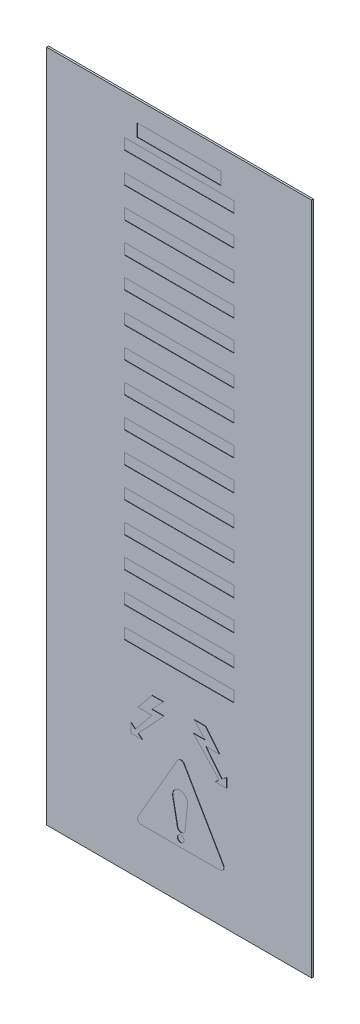
from build123d import *

# Parameters (mm, degrees)
CROQUIS2_W              = 70
CROQUIS2_H              = 178
SALIENTE_EXTRUIR1_DEPTH = 0.5
SALIENTE_EXTRUIR3_DEPTH = 0.1
CROQUIS7_W              = 22.17688196
CROQUIS7_H              = 3.307809841
CORTAR_EXTRUIR1_DEPTH   = 0.1
CROQUIS12_R             = 0.884703758
CORTAR_EXTRUIR6_DEPTH   = 0.1
SALIENTE_EXTRUIR7_DEPTH = 0.1
CROQUIS14_W             = 28.951405582
CROQUIS14_H             = 2.886934834
CORTAR_EXTRUIR9_DEPTH   = 0.1


with BuildPart() as part:
    # Croquis2 → Saliente-Extruir1 (new body)
    with BuildSketch(Plane.XY):
        Rectangle(CROQUIS2_W, CROQUIS2_H)
    extrude(amount=SALIENTE_EXTRUIR1_DEPTH)

    # Croquis3 → Saliente-Extruir3 (add)
    with BuildSketch(Plane.XY.offset(0.5)):
        with BuildLine():
            Line((-9.855540385, -76.309745211), (10.927527897, -76.309745211))
            ThreePointArc((10.927527897, -76.309745211), (11.793597531, -75.809668594), (11.79346482, -74.809591989))
            Line((11.79346482, -74.809591989), (1.401930679, -56.818279148))
            ThreePointArc((1.401930679, -56.818279148), (0.535993756, -56.31843237), (-0.329943167, -56.818279148))
            Line((-0.329943167, -56.818279148), (-10.721477308, -74.809591989))
            ThreePointArc((-10.721477308, -74.809591989), (-10.721610019, -75.809668594), (-9.855540385, -76.309745211))
        make_face()
    extrude(amount=SALIENTE_EXTRUIR3_DEPTH)

    # Croquis7 → Cortar-Extruir1 (cut)
    with BuildSketch(Plane.XY.offset(0.5)):
        with Locations((0, 81.996928937)):
            Rectangle(CROQUIS7_W, CROQUIS7_H)
    extrude(amount=-CORTAR_EXTRUIR1_DEPTH, mode=Mode.SUBTRACT)

    # Croquis12 → Cortar-Extruir6 (cut)
    with BuildSketch(Plane.XY.offset(0.6)):
        with Locations((0.537972258, -74.332087137)):
            Circle(CROQUIS12_R)
        with BuildLine():
            Line((-0.348710002, -71.972665126), (-1.628640607, -65.425857317))
            ThreePointArc((-1.628640607, -65.425857317), (0.302962598, -63.346803486), (2.382016429, -65.278406691))
            Line((2.382016429, -65.278406691), (1.678502804, -71.951849763))
            ThreePointArc((1.678502804, -71.951849763), (0.674168301, -72.865249783), (-0.348710002, -71.972665126))
        make_face()
    extrude(amount=-CORTAR_EXTRUIR6_DEPTH, mode=Mode.SUBTRACT)

    # Croquis4 → Saliente-Extruir7 (add)
    with BuildSketch(Plane.XY.offset(0.5)):
        Polygon((-4.107800338, -45.327798296), (-7.077418664, -45.327798296), (-10.721484373, -49.854681807), (-7.077418664, -49.854681807), (-11.437215381, -55.270690584), (-12.621463736, -54.317390413), (-12.621463736, -56.74183704), (-9.609666384, -56.74183704), (-10.721484373, -55.846842105), (-3.908016847, -48.520813848), (-7.077418664, -48.520813848), align=None)
        Polygon((9.609666384, -56.74183704), (10.721484373, -55.846842105), (3.908016847, -48.520813848), (7.077418664, -48.520813848), (4.107800338, -45.327798296), (7.077418664, -45.327798296), (10.721484373, -49.854681807), (7.077418664, -49.854681807), (11.437215381, -55.270690584), (12.621463736, -54.317390413), (12.621463736, -56.74183704), align=None)
    extrude(amount=SALIENTE_EXTRUIR7_DEPTH)

    # Croquis14 → Cortar-Extruir9 (cut)
    with BuildSketch(Plane.XY.offset(0.5)):
        with Locations((0, 77.150486091)):
            Rectangle(CROQUIS14_W, CROQUIS14_H)
        with Locations((0, 69.150486091)):
            Rectangle(CROQUIS14_W, CROQUIS14_H)
        with Locations((0, 61.150486091)):
            Rectangle(CROQUIS14_W, CROQUIS14_H)
        with Locations((0, 53.150486091)):
            Rectangle(CROQUIS14_W, CROQUIS14_H)
        with Locations((0, 45.150486091)):
            Rectangle(CROQUIS14_W, CROQUIS14_H)
        with Locations((0, 37.150486091)):
            Rectangle(CROQUIS14_W, CROQUIS14_H)
        with Locations((0, 29.150486091)):
            Rectangle(CROQUIS14_W, CROQUIS14_H)
        with Locations((0, 21.150486091)):
            Rectangle(CROQUIS14_W, CROQUIS14_H)
        with Locations((0, 13.150486091)):
            Rectangle(CROQUIS14_W, CROQUIS14_H)
        with Locations((0, 5.150486091)):
            Rectangle(CROQUIS14_W, CROQUIS14_H)
        with Locations((0, -2.849513909)):
            Rectangle(CROQUIS14_W, CROQUIS14_H)
        with Locations((0, -10.849513909)):
            Rectangle(CROQUIS14_W, CROQUIS14_H)
        with Locations((0, -18.849513909)):
            Rectangle(CROQUIS14_W, CROQUIS14_H)
        with Locations((0, -26.849513909)):
            Rectangle(CROQUIS14_W, CROQUIS14_H)
        with Locations((0, -34.849513909)):
            Rectangle(CROQUIS14_W, CROQUIS14_H)
    extrude(amount=-CORTAR_EXTRUIR9_DEPTH, mode=Mode.SUBTRACT)


solid = part.part
